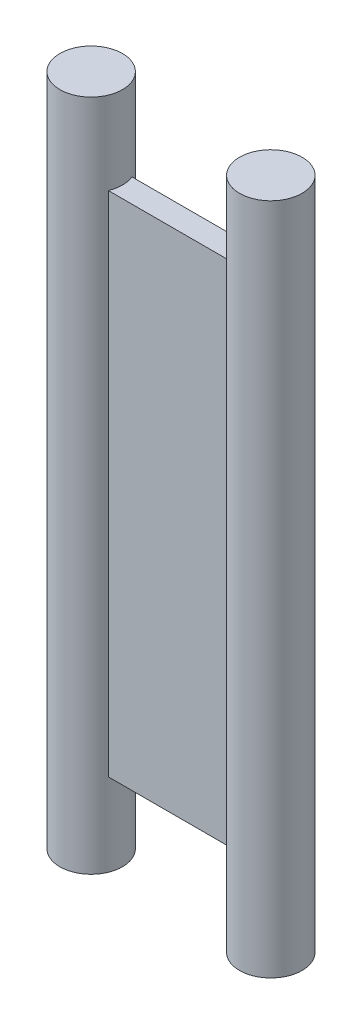
from build123d import *

# Parameters (mm, degrees)
SKETCH1_W           = 7.606
SKETCH1_H           = 1
BOSS_EXTRUDE1_DEPTH = 21.5
SKETCH2_R           = 1.325
BOSS_EXTRUDE2_DEPTH = 14.25


with BuildPart() as part:
    # Sketch1 → Boss-Extrude1 (new body)
    with BuildSketch(Plane(origin=(0, 0, 0), x_dir=(1, 0, 0), z_dir=(0, 1, 0))):
        Rectangle(SKETCH1_W, SKETCH1_H)
    extrude(amount=BOSS_EXTRUDE1_DEPTH)

    # Sketch2 → Boss-Extrude2 (add, symmetric)
    with BuildSketch(Plane(origin=(0, 10.75, 0), x_dir=(1, 0, 0), z_dir=(0, 1, 0))):
        with Locations(Location((-3.803, 0, 0), (0, 0, 270))):
            Circle(SKETCH2_R)
        with Locations(Location((3.803, 0, 0), (0, 0, 270))):
            Circle(SKETCH2_R)
    extrude(amount=BOSS_EXTRUDE2_DEPTH, both=True)


solid = part.part
